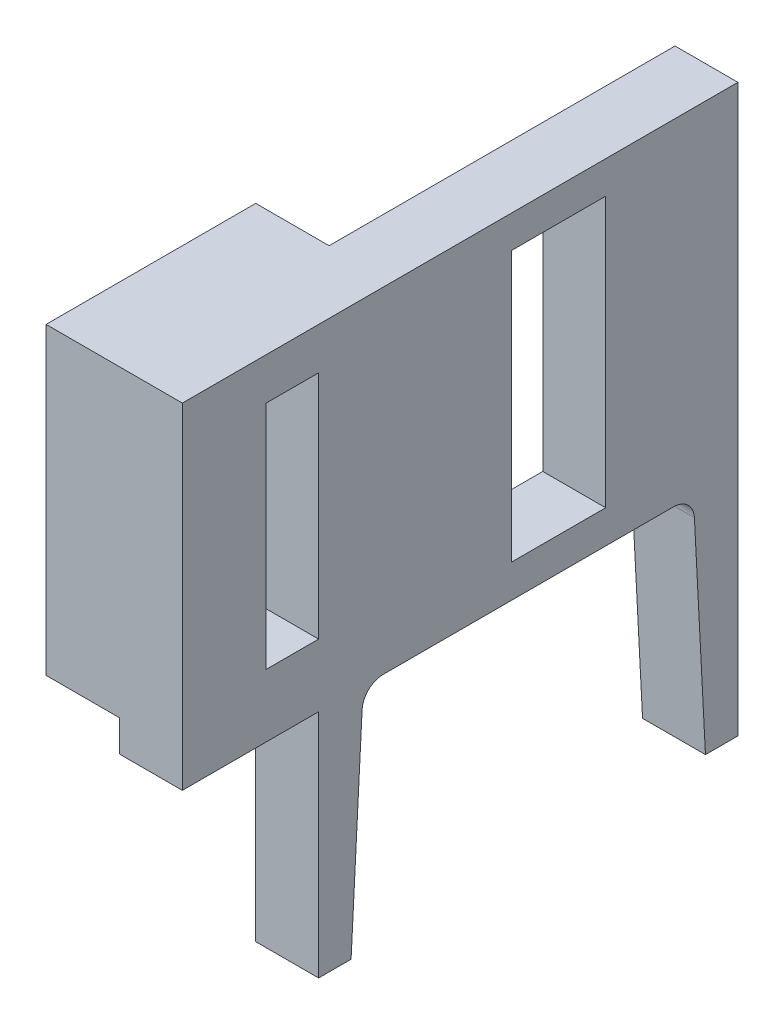
from build123d import *

# Parameters (mm, degrees)
SKETCH1_W           = 53
SKETCH1_H           = 32
BOSS_EXTRUDE1_DEPTH = 13
SKETCH7_W           = 7
SKETCH7_H           = 40
CUT_EXTRUDE3_DEPTH  = 44.534469102
SKETCH8_W           = 6
SKETCH8_H           = 40
BOSS_EXTRUDE2_DEPTH = 22
SKETCH20_W          = 6
SKETCH20_H          = 31.5
CUT_EXTRUDE9_DEPTH  = 44.534469102
CUT_EXTRUDE9_DRAFT  = -3
FILLET1_R           = 2
FILLET2_R           = 2
SKETCH49_W          = 7
SKETCH49_H          = 32
BOSS_EXTRUDE3_DEPTH = 7
SKETCH50_W          = 7
SKETCH50_H          = 20
CUT_EXTRUDE19_DEPTH = 3
SKETCH35_W          = 9
SKETCH35_H          = 25.742086546
CUT_EXTRUDE15_DEPTH = 47.853495067
SKETCH36_W          = 8.51187264
SKETCH36_H          = 25.698199293
CUT_EXTRUDE16_DEPTH = 5
SKETCH55_W          = 8.650111134
SKETCH55_H          = 26.010357873
CUT_EXTRUDE20_DEPTH = 5
SKETCH63_W          = 5
SKETCH63_H          = 22
CUT_EXTRUDE21_DEPTH = 49.117044797


with BuildPart() as part:
    # Sketch1 → Boss-Extrude1 (new body)
    with BuildSketch(Plane(origin=(0, 0, 0), x_dir=(0, 0, -1), z_dir=(1, 0, 0))):
        Rectangle(SKETCH1_W, SKETCH1_H)
    extrude(amount=BOSS_EXTRUDE1_DEPTH)

    # Sketch7 → Cut-Extrude3 (cut, through all)
    with BuildSketch(Plane(origin=(0, 16, 0), x_dir=(1, 0, 0), z_dir=(0, 1, 0))):
        with Locations((3.5, 6.5)):
            Rectangle(SKETCH7_W, SKETCH7_H)
    extrude(amount=-CUT_EXTRUDE3_DEPTH, mode=Mode.SUBTRACT)

    # Sketch8 → Boss-Extrude2 (add)
    with BuildSketch(Plane.XZ.offset(16)):
        with Locations((10, -6.5)):
            Rectangle(SKETCH8_W, SKETCH8_H)
    extrude(amount=BOSS_EXTRUDE2_DEPTH)


with BuildPart() as cut_extrude9_tool:
    # Sketch20 → Cut-Extrude9 (with draft: the straight prism first)
    with BuildSketch(Plane(origin=(0, -16, 0), x_dir=(-1, 0, 0), z_dir=(0, -1, 0))):
        with Locations((-10, 6.5)):
            Rectangle(SKETCH20_W, SKETCH20_H)
    extrude(amount=CUT_EXTRUDE9_DEPTH)
    # Cut-Extrude9: the draft: its side faces are tilted about the plane it starts from
    cut_extrude9_sides = [cut_extrude9_tool.faces().sort_by_distance(p)[0] for p in [
        (10, -38.267234551, 9.25),
        (7, -38.267234551, -6.5),
        (10, -38.267234551, -22.25),
        (13, -38.267234551, -6.5),
    ]]
    draft(cut_extrude9_sides, Plane(origin=(0, -16, 0), x_dir=(-1, 0, 0), z_dir=(0, -1, 0)), CUT_EXTRUDE9_DRAFT)


with BuildPart() as part_1:
    add(part.part)

    # Cut-Extrude9: cut by cut_extrude9_tool
    add(cut_extrude9_tool.part, mode=Mode.SUBTRACT)

    # Fillet1
    fillet1_edges = [part_1.edges().sort_by_distance(p)[0] for p in [
        (10, -16, -22.25),
    ]]
    fillet(fillet1_edges, radius=FILLET1_R)

    # Fillet2
    fillet2_edges = [part_1.edges().sort_by_distance(p)[0] for p in [
        (10, -16, 9.25),
    ]]
    fillet(fillet2_edges, radius=FILLET2_R)

    # Sketch49 → Boss-Extrude3 (add)
    with BuildSketch(Plane(origin=(0, 0, 13.5), x_dir=(-1, 0, 0), z_dir=(0, 0, -1))):
        with Locations((-3.5, 0)):
            Rectangle(SKETCH49_W, SKETCH49_H)
    extrude(amount=BOSS_EXTRUDE3_DEPTH)

    # Sketch50 → Cut-Extrude19 (cut)
    with BuildSketch(Plane.XZ.offset(16)):
        with Locations((3.5, 16.5)):
            Rectangle(SKETCH50_W, SKETCH50_H)
    extrude(amount=-CUT_EXTRUDE19_DEPTH, mode=Mode.SUBTRACT)

    # Sketch35 → Cut-Extrude15 (cut, through all)
    with BuildSketch(Plane.ZY.offset(-7)):
        with Locations((-9.381446742, 0.030527838)):
            Rectangle(SKETCH35_W, SKETCH35_H)
    extrude(amount=-CUT_EXTRUDE15_DEPTH, mode=Mode.SUBTRACT)

    # Sketch36 → Cut-Extrude16 (cut)
    with BuildSketch(Plane.ZY.offset(-7)):
        with Locations((0.636992311, -0.150900353)):
            Rectangle(SKETCH36_W, SKETCH36_H)
    extrude(amount=-CUT_EXTRUDE16_DEPTH, mode=Mode.SUBTRACT)

    # Sketch55 → Cut-Extrude20 (cut)
    with BuildSketch(Plane.ZY.offset(-7)):
        with Locations((-20.206502309, -0.103607826)):
            Rectangle(SKETCH55_W, SKETCH55_H)
    extrude(amount=-CUT_EXTRUDE20_DEPTH, mode=Mode.SUBTRACT)

    # Sketch63 → Cut-Extrude21 (cut, through all)
    with BuildSketch(Plane.ZY):
        with Locations((16, 1)):
            Rectangle(SKETCH63_W, SKETCH63_H)
    extrude(amount=-CUT_EXTRUDE21_DEPTH, mode=Mode.SUBTRACT)


solid = part_1.part
